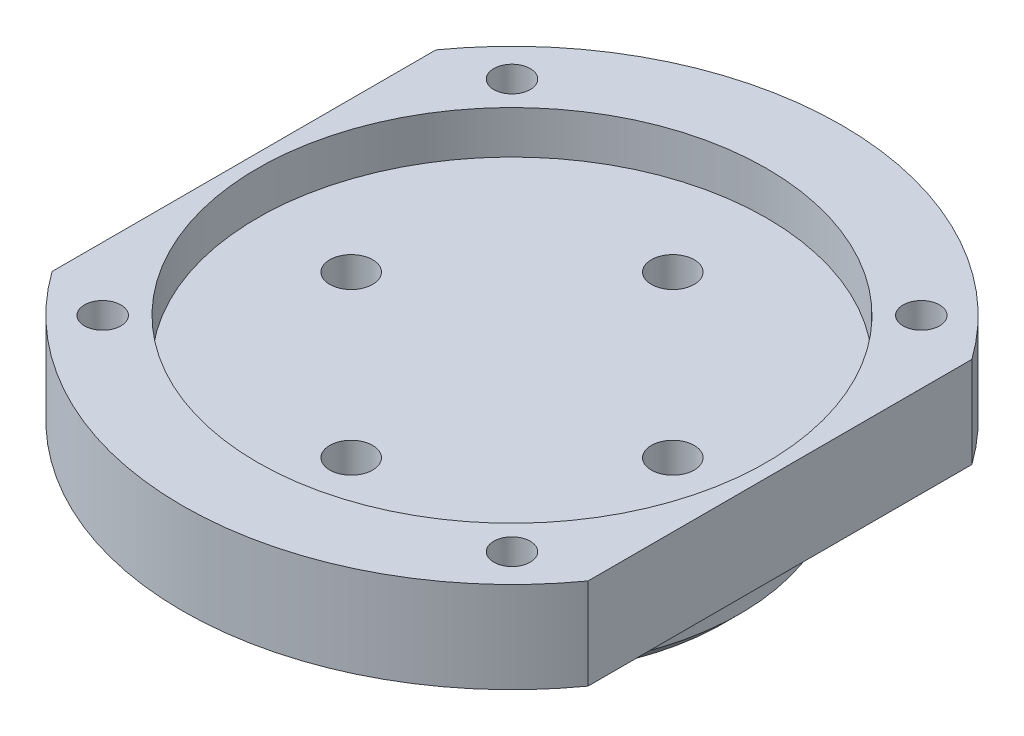
from build123d import *

# Parameters (mm, degrees)
CUT_EXTRUDE3_START          = -17
SKETCH4_OUTSIDE_W           = 160.304
SKETCH4_OUTSIDE_H           = 160.304
SKETCH4_OUTSIDE_W_2         = 100
SKETCH4_OUTSIDE_H_2         = 123
CUT_EXTRUDE3_DEPTH          = 17
CUT_EXTRUDE4_REACH          = 86.748
SKETCH5_R                   = 2.5
SKETCH2_R                   = 4
CUT_EXTRUDE5_DEPTH          = 85.748156322
SKETCH6_R                   = 8
CUT_EXTRUDE6_DEPTH          = 13
CHAMFER1_SIZE               = 3
M8_TAPPED_HOLE1_D           = 6.8
M8_TAPPED_HOLE1_DEPTH       = 19.75
M8_TAPPED_HOLE1_CSINK_D     = 8.05
M8_TAPPED_HOLE1_CSINK_ANGLE = 90
M8_TAPPED_HOLE1_TIP         = 2.042926105


with BuildPart() as part:
    # Sketch1 → Revolve1 (revolve)
    with BuildSketch(Plane.XY, mode=Mode.PRIVATE) as revolve1_sk:
        Polygon((42.5, 0), (42.5, 13), (61.5, 13), (61.5, 30), (47.5, 30), (47.5, 22), (0, 22), (0, 0), align=None)
    revolve(revolve1_sk.sketch.rotate(Axis((0, 0, 0), (0, 1, 0)), 90), axis=Axis((0, 0, 0), (0, 1, 0)))

    # Sketch4 outside → Cut-Extrude3 (cut)
    with BuildSketch(Plane(origin=(0, 30, 0), x_dir=(1, 0, 0), z_dir=(0, 1, 0)).offset(CUT_EXTRUDE3_START)):
        Rectangle(SKETCH4_OUTSIDE_W, SKETCH4_OUTSIDE_H)
        Rectangle(SKETCH4_OUTSIDE_W_2, SKETCH4_OUTSIDE_H_2, mode=Mode.SUBTRACT)
    extrude(amount=CUT_EXTRUDE3_DEPTH, mode=Mode.SUBTRACT)

    # Sketch5 → Cut-Extrude4 (cut, up to next)
    with BuildSketch(Plane(origin=(0, 30, 0), x_dir=(1, 0, 0), z_dir=(0, 1, 0)), mode=Mode.PRIVATE) as cut_extrude4_sk1:
        with Locations(Location((-38.183766184, 38.183766184, 0), (0, 0, 270))):
            Circle(SKETCH5_R)
    cut_extrude4_tool1 = extrude(cut_extrude4_sk1.sketch, amount=-CUT_EXTRUDE4_REACH, mode=Mode.PRIVATE) & part.part
    # Sketch5 → Cut-Extrude4 (cut, up to next)
    with BuildSketch(Plane(origin=(0, 30, 0), x_dir=(1, 0, 0), z_dir=(0, 1, 0)), mode=Mode.PRIVATE) as cut_extrude4_sk2:
        with Locations(Location((38.183766184, 38.183766184, 0), (0, 0, 270))):
            Circle(SKETCH5_R)
    cut_extrude4_tool2 = extrude(cut_extrude4_sk2.sketch, amount=-CUT_EXTRUDE4_REACH, mode=Mode.PRIVATE) & part.part
    # Sketch5 → Cut-Extrude4 (cut, up to next)
    with BuildSketch(Plane(origin=(0, 30, 0), x_dir=(1, 0, 0), z_dir=(0, 1, 0)), mode=Mode.PRIVATE) as cut_extrude4_sk3:
        with Locations(Location((38.183766184, -38.183766184, 0), (0, 0, 270))):
            Circle(SKETCH5_R)
    cut_extrude4_tool3 = extrude(cut_extrude4_sk3.sketch, amount=-CUT_EXTRUDE4_REACH, mode=Mode.PRIVATE) & part.part
    # Sketch5 → Cut-Extrude4 (cut, up to next)
    with BuildSketch(Plane(origin=(0, 30, 0), x_dir=(1, 0, 0), z_dir=(0, 1, 0)), mode=Mode.PRIVATE) as cut_extrude4_sk4:
        with Locations(Location((-38.183766184, -38.183766184, 0), (0, 0, 270))):
            Circle(SKETCH5_R)
    cut_extrude4_tool4 = extrude(cut_extrude4_sk4.sketch, amount=-CUT_EXTRUDE4_REACH, mode=Mode.PRIVATE) & part.part
    add(cut_extrude4_tool1.solids().sort_by_distance((-38.183766, 30, -38.183766))[0], mode=Mode.SUBTRACT)
    add(cut_extrude4_tool2.solids().sort_by_distance((38.183766, 30, -38.183766))[0], mode=Mode.SUBTRACT)
    add(cut_extrude4_tool3.solids().sort_by_distance((38.183766, 30, 38.183766))[0], mode=Mode.SUBTRACT)
    add(cut_extrude4_tool4.solids().sort_by_distance((-38.183766, 30, 38.183766))[0], mode=Mode.SUBTRACT)

    # Sketch2 → Cut-Extrude5 (cut, through all)
    with BuildSketch(Plane.XZ):
        with Locations(Location((30, 0, 0), (0, 0, 270))):
            Circle(SKETCH2_R)
        with Locations(Location((0, -30, 0), (0, 0, 270))):
            Circle(SKETCH2_R)
        with Locations(Location((-30, 0, 0), (0, 0, 270))):
            Circle(SKETCH2_R)
        with Locations(Location((0, 30, 0), (0, 0, 270))):
            Circle(SKETCH2_R)
    extrude(amount=-CUT_EXTRUDE5_DEPTH, mode=Mode.SUBTRACT)

    # Sketch6 → Cut-Extrude6 (cut)
    with BuildSketch(Plane.XZ):
        with Locations(Location((0, 30, 0), (0, 0, 270))):
            Circle(SKETCH6_R)
        with Locations(Location((30, 0, 0), (0, 0, 270))):
            Circle(SKETCH6_R)
        with Locations(Location((-30, 0, 0), (0, 0, 270))):
            Circle(SKETCH6_R)
        with Locations(Location((0, -30, 0), (0, 0, 270))):
            Circle(SKETCH6_R)
    extrude(amount=-CUT_EXTRUDE6_DEPTH, mode=Mode.SUBTRACT)

    # Chamfer1
    chamfer1_edges = [part.edges().sort_by_distance(p)[0] for p in [
        (0, 0, 42.5),
    ]]
    chamfer(chamfer1_edges, length=CHAMFER1_SIZE)

    # M8 Tapped Hole1
    with Locations(Plane(origin=(38.183766184, 13, -38.183766184), x_dir=(0, 0, -1), z_dir=(0, -1, 0))):
        with Locations((0, 0), (0, -76.367532368), (-76.367532368, -76.367532368), (-76.367532368, 0)):
            CounterSinkHole(M8_TAPPED_HOLE1_D / 2, M8_TAPPED_HOLE1_CSINK_D / 2, depth=M8_TAPPED_HOLE1_DEPTH, counter_sink_angle=M8_TAPPED_HOLE1_CSINK_ANGLE)
            with Locations((0, 0, -(M8_TAPPED_HOLE1_DEPTH + M8_TAPPED_HOLE1_TIP / 2))):  # 118° drill point
                Cone(0, M8_TAPPED_HOLE1_D / 2, M8_TAPPED_HOLE1_TIP, mode=Mode.SUBTRACT)


solid = part.part
